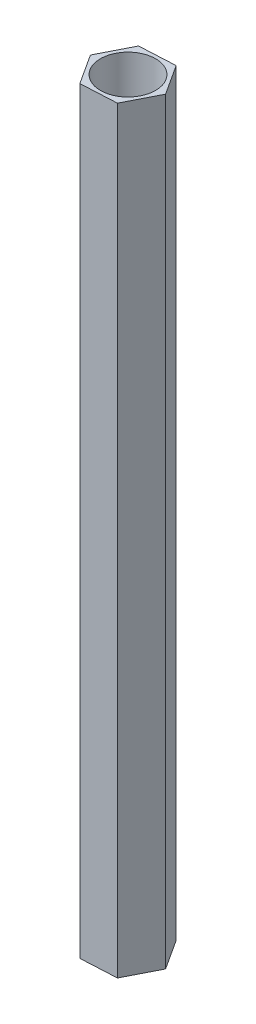
from build123d import *

# Parameters (mm, degrees)
SKETCH1_R           = 2
BOSS_EXTRUDE1_DEPTH = 55


with BuildPart() as part:
    # Sketch1 → Boss-Extrude1 (new body)
    with BuildSketch(Plane(origin=(0, 0, 0), x_dir=(1, 0, 0), z_dir=(0, 1, 0))):
        Polygon((1.413277895, -2.180056328), (2.594623109, 0.133906396), (1.181345214, 2.313962724), (-1.413277895, 2.180056328), (-2.594623109, -0.133906396), (-1.181345214, -2.313962724), align=None)
        with Locations(Location((0, 0, 0), (0, 0, 270))):
            Circle(SKETCH1_R, mode=Mode.SUBTRACT)
    extrude(amount=BOSS_EXTRUDE1_DEPTH)


solid = part.part
